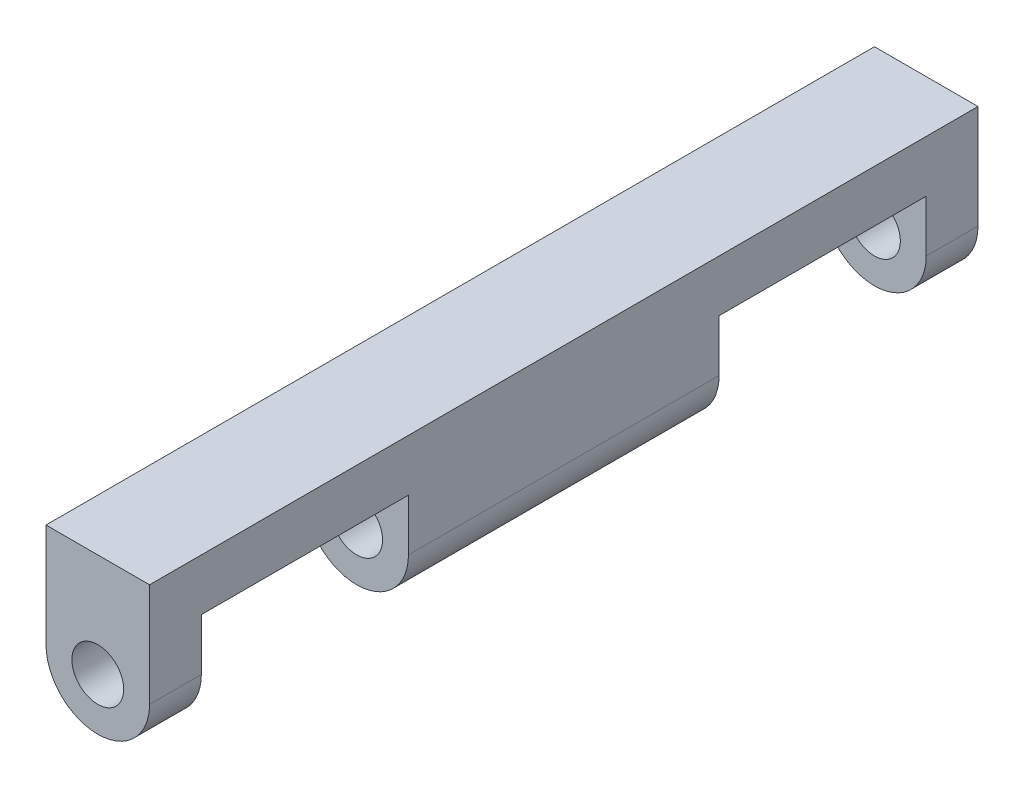
from build123d import *

# Parameters (mm, degrees)
SKETCH_1_R          = 2.5
EXTRUDE_1_DEPTH     = 80
SKETCH_2_W          = 20
SKETCH_2_H          = 15
CUT_EXTRUDE_1_DEPTH = 80


with BuildPart() as part:
    # 草图1 → 凸台-拉伸1 (new body)
    with BuildSketch(Plane.XY):
        with BuildLine():
            Line((-5, 10), (5, 10))
            Line((5, 10), (5, 0))
            ThreePointArc((5, 0), (0, -5), (-5, 0))
            Line((-5, 0), (-5, 10))
        make_face()
        Circle(SKETCH_1_R, mode=Mode.SUBTRACT)
    extrude(amount=EXTRUDE_1_DEPTH)

    # 草图2 → 切除-拉伸1 (cut)
    with BuildSketch(Plane(origin=(5, 0, 0), x_dir=(0, 0, -1), z_dir=(1, 0, 0))):
        with Locations((-15, -2.5)):
            Rectangle(SKETCH_2_W, SKETCH_2_H)
        with Locations((-65, -2.5)):
            Rectangle(SKETCH_2_W, SKETCH_2_H)
    extrude(amount=-CUT_EXTRUDE_1_DEPTH, mode=Mode.SUBTRACT)


solid = part.part
